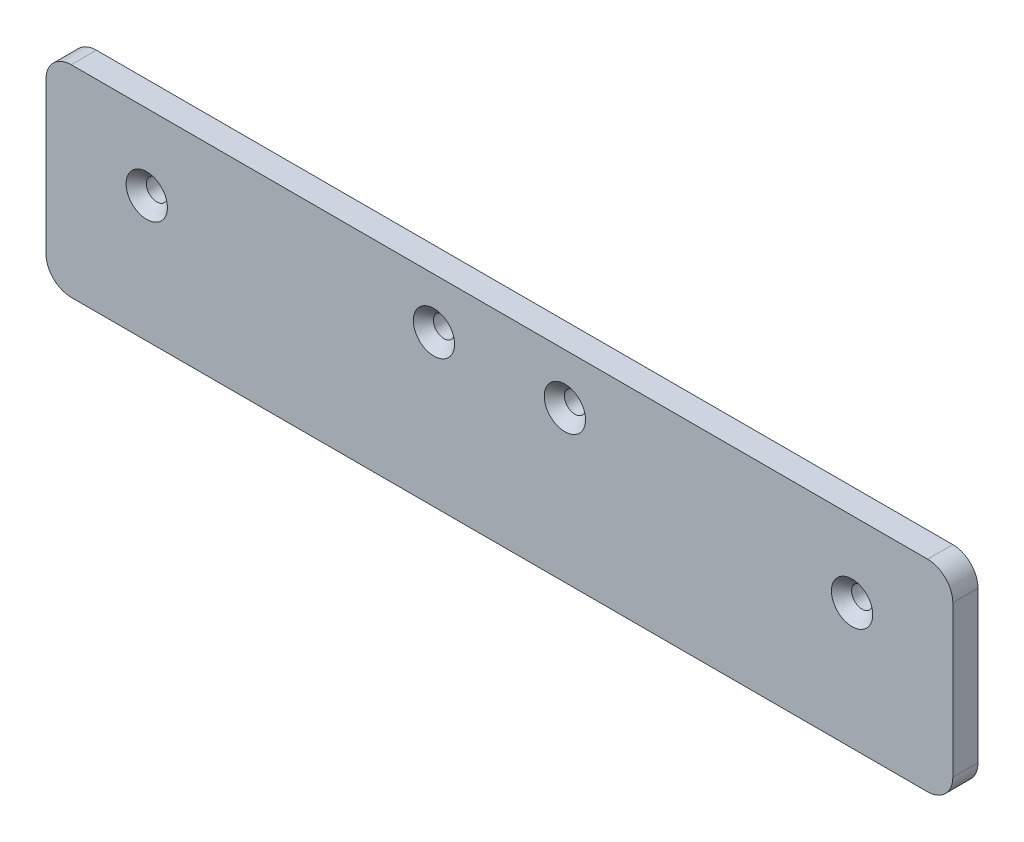
from build123d import *

# Parameters (mm, degrees)
SZKIC1_W                    = 180
SZKIC1_H                    = 40
DODANIE_WYCI_GNI_CIE1_DEPTH = 5
ZAOKR_GLENIE1_R             = 5
SZKIC2_R                    = 2.1
WYTNIJ_WYCI_GNI_CIE1_DEPTH  = 5
SFAZOWANIE1_SIZE            = 2


with BuildPart() as part:
    # Szkic1 → Dodanie-wyciągnięcie1 (new body)
    with BuildSketch(Plane.XY):
        Rectangle(SZKIC1_W, SZKIC1_H)
    extrude(amount=DODANIE_WYCI_GNI_CIE1_DEPTH)

    # Zaokrąglenie1
    zaokr_glenie1_edges = [part.edges().sort_by_distance(p)[0] for p in [
        (90, -20, 2.5),
        (-90, -20, 2.5),
        (-90, 20, 2.5),
        (90, 20, 2.5),
    ]]
    fillet(zaokr_glenie1_edges, radius=ZAOKR_GLENIE1_R)

    # Szkic2 → Wytnij-wyciągnięcie1 (cut)
    with BuildSketch(Plane.XY.offset(5)):
        with Locations((-70, 5)):
            Circle(SZKIC2_R)
        with Locations((-13, 10)):
            Circle(SZKIC2_R)
        with Locations((13, 10)):
            Circle(SZKIC2_R)
        with Locations((70, 5)):
            Circle(SZKIC2_R)
    extrude(amount=-WYTNIJ_WYCI_GNI_CIE1_DEPTH, mode=Mode.SUBTRACT)

    # Sfazowanie1
    sfazowanie1_edges = [part.edges().sort_by_distance(p)[0] for p in [
        (-72.1, 5, 5),
        (-15.1, 10, 5),
        (10.9, 10, 5),
        (67.9, 5, 5),
    ]]
    chamfer(sfazowanie1_edges, length=SFAZOWANIE1_SIZE)


solid = part.part
